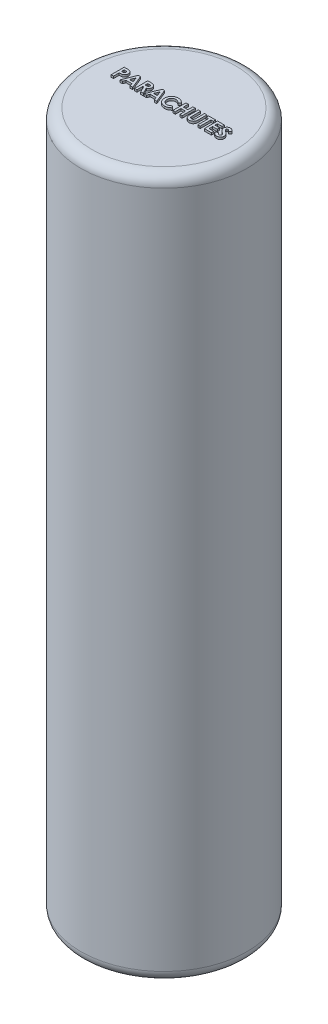
from build123d import *

# Parameters (mm, degrees)
SKETCH1_R           = 48.26
BOSS_EXTRUDE1_DEPTH = 406.4
FILLET1_R           = 6.35
BOSS_EXTRUDE2_DEPTH = 1.27
CUT_EXTRUDE1_DEPTH  = 0.635


with BuildPart() as part:
    # Sketch1 → Boss-Extrude1 (new body)
    with BuildSketch(Plane(origin=(0, 0, 0), x_dir=(1, 0, 0), z_dir=(0, 1, 0))):
        with Locations(Location((0, 0, 0), (0, 0, 270))):
            Circle(SKETCH1_R)
    extrude(amount=BOSS_EXTRUDE1_DEPTH)

    # Fillet1
    fillet1_edges = [part.edges().sort_by_distance(p)[0] for p in [
        (0, 0, -48.26),
        (0, 406.4, -48.26),
    ]]
    fillet(fillet1_edges, radius=FILLET1_R)

    # Sketch2 → Boss-Extrude2 (add)
    # profile 1 of 10: a face of its own
    with BuildSketch(Plane(origin=(0, 406.4, 0), x_dir=(1, 0, 0), z_dir=(0, 1, 0))):
        with BuildLine():
            Line((32.824615385, 6.601862981), (31.801899038, 5.666153846))
            add(Edge.make_bspline(
                [(31.801899038, 5.666153846), (31.758090256, 5.727950689), (31.673983502, 5.846592009), (31.537655226, 6.005455533), (31.401942543, 6.140977942), (31.265588156, 6.252593085), (31.127383472, 6.339622817), (30.987568394, 6.401240829), (30.846935574, 6.440411984), (30.752452027, 6.445289735), (30.705913462, 6.447692308)],
                knots=[0, 0, 0, 0, 1.299362458, 2.494594718, 3.587462134, 4.587049575, 5.512617175, 6.380583204, 7.202344345, 8, 8, 8, 8], degree=3))
            add(Edge.make_bspline(
                [(30.705913462, 6.447692308), (30.662503622, 6.446169928), (30.578690628, 6.443230612), (30.459208986, 6.414014032), (30.353131483, 6.363590506), (30.260561645, 6.297657503), (30.187232676, 6.218223521), (30.128685181, 6.134917697), (30.095718021, 6.042966909), (30.091378894, 5.979811397), (30.089230769, 5.948545673)],
                knots=[0, 0, 0, 0, 1.185010067, 2.2879431, 3.333075148, 4.379039566, 5.372662701, 6.27520591, 7.14612461, 8, 8, 8, 8], degree=3))
            add(Edge.make_bspline(
                [(30.089230769, 5.948545673), (30.09057689, 5.916829083), (30.093287791, 5.852956278), (30.119471404, 5.759342728), (30.158937585, 5.667871393), (30.196649133, 5.612188438), (30.215925481, 5.583725962)],
                knots=[0, 0, 0, 0, 0.967525499, 1.948461899, 2.951351359, 4, 4, 4, 4], degree=3))
            add(Edge.make_bspline(
                [(30.215925481, 5.583725962), (30.233449767, 5.561602376), (30.273788358, 5.510676805), (30.35070579, 5.430018639), (30.447297931, 5.331205325), (30.567281849, 5.217634764), (30.705676682, 5.085222515), (30.86889721, 4.939173752), (31.052245233, 4.774965516), (31.18256476, 4.660616847), (31.250853365, 4.600697115)],
                knots=[0, 0, 0, 0, 0.473873513, 1.090794244, 1.870441696, 2.795289791, 3.865433203, 5.087734844, 6.473946851, 8, 8, 8, 8], degree=3))
            add(Edge.make_bspline(
                [(31.250853365, 4.600697115), (31.314952044, 4.545222942), (31.43659802, 4.439944486), (31.609676087, 4.290518621), (31.761782882, 4.156083813), (31.895134254, 4.038657642), (32.007708726, 3.937008039), (32.099979562, 3.850649119), (32.173073693, 3.781262131), (32.214623427, 3.739352348), (32.232355769, 3.721466346)],
                knots=[0, 0, 0, 0, 1.543621617, 2.929473131, 4.163658386, 5.240097082, 6.164993805, 6.925417477, 7.541396219, 8, 8, 8, 8], degree=3))
            add(Edge.make_bspline(
                [(32.232355769, 3.721466346), (32.299628579, 3.648662758), (32.428950544, 3.508708695), (32.59702351, 3.291823912), (32.735352998, 3.08010014), (32.842367312, 2.869553453), (32.923188827, 2.657146081), (32.980169065, 2.437668745), (33.014294909, 2.208828044), (33.018083675, 2.052672202), (33.02, 1.973689904)],
                knots=[0, 0, 0, 0, 1.206664779, 2.319633467, 3.337109185, 4.282041471, 5.190008762, 6.099243693, 7.03861361, 8, 8, 8, 8], degree=3))
            add(Edge.make_bspline(
                [(33.02, 1.973689904), (33.018636009, 1.896731341), (33.015959807, 1.745735775), (32.983181468, 1.524776257), (32.93644148, 1.313308408), (32.864173259, 1.113633298), (32.776093179, 0.922473321), (32.665672078, 0.742806141), (32.535997635, 0.572813452), (32.387370813, 0.415534083), (32.2229719, 0.272813957), (32.046638441, 0.14576113), (31.85664616, 0.040862837), (31.654618319, -0.045513424), (31.440663062, -0.112041576), (31.215035271, -0.16121208), (30.977389835, -0.190723442), (30.814884462, -0.193808505), (30.731862981, -0.195384615)],
                knots=[0, 0, 0, 0, 1.043214005, 2.046824704, 3.02475056, 3.976699089, 4.921714032, 5.875962561, 6.831408892, 7.817874052, 8.806269674, 9.781291748, 10.760897367, 11.74438705, 12.757449933, 13.795994037, 14.874007457, 16, 16, 16, 16], degree=3))
            add(Edge.make_bspline(
                [(30.731862981, -0.195384615), (30.666691825, -0.194228436), (30.537615562, -0.191938537), (30.347376663, -0.173243418), (30.163679502, -0.143071486), (29.986730995, -0.099826094), (29.815733959, -0.045028317), (29.650681371, 0.021905068), (29.492712645, 0.102011505), (29.340632513, 0.193643685), (29.195180273, 0.300040716), (29.054516739, 0.419027346), (28.920039114, 0.552433643), (28.791101529, 0.699944104), (28.668528964, 0.861976446), (28.548309178, 1.036274067), (28.4357851, 1.226071695), (28.366273972, 1.359216266), (28.330769231, 1.427223558)],
                knots=[0, 0, 0, 0, 1.016823716, 2.013894106, 2.979844003, 3.91962641, 4.853723003, 5.779685073, 6.695824784, 7.614987388, 8.547259901, 9.504950863, 10.487499108, 11.500346958, 12.559593716, 13.656357062, 14.802919212, 16, 16, 16, 16], degree=3))
            Line((28.330769231, 1.427223558), (29.533605769, 2.149230769))
            add(Edge.make_bspline(
                [(29.533605769, 2.149230769), (29.578016894, 2.072033608), (29.663156816, 1.924040052), (29.807434373, 1.725191952), (29.955239365, 1.55491147), (30.109988911, 1.416208324), (30.269801313, 1.307227875), (30.435448504, 1.229342885), (30.607046862, 1.181132165), (30.723931869, 1.175244522), (30.782235577, 1.172307692)],
                knots=[0, 0, 0, 0, 1.283663364, 2.460892379, 3.537111102, 4.529833553, 5.449777664, 6.316464042, 7.160231139, 8, 8, 8, 8], degree=3))
            add(Edge.make_bspline(
                [(30.782235577, 1.172307692), (30.841538795, 1.174706067), (30.956595675, 1.179359263), (31.120824648, 1.222339431), (31.271395989, 1.289821449), (31.401548744, 1.386108982), (31.511753891, 1.49723943), (31.593091615, 1.620877134), (31.644188522, 1.754650146), (31.649590704, 1.847577679), (31.652307692, 1.894314904)],
                knots=[0, 0, 0, 0, 1.13588714, 2.203786484, 3.234766741, 4.283437687, 5.291419208, 6.222934724, 7.106237994, 8, 8, 8, 8], degree=3))
            add(Edge.make_bspline(
                [(31.652307692, 1.894314904), (31.649798665, 1.937796286), (31.644701817, 2.02612455), (31.607160002, 2.157454476), (31.548470694, 2.288724676), (31.479037104, 2.396396045), (31.408379733, 2.486546364), (31.340815348, 2.564657538), (31.258539801, 2.650956709), (31.161761706, 2.745552437), (31.051759754, 2.849277472), (30.928441282, 2.962121655), (30.790394163, 3.083090966), (30.692822187, 3.165494065), (30.641802885, 3.208581731)],
                knots=[0, 0, 0, 0, 0.916159276, 1.861089862, 2.860218735, 3.940849679, 4.552606315, 5.27541173, 6.11797699, 7.06649574, 8.129236253, 9.306560635, 10.591630461, 12, 12, 12, 12], degree=3))
            add(Edge.make_bspline(
                [(30.641802885, 3.208581731), (30.544813159, 3.290644339), (30.35866052, 3.448147322), (30.095603223, 3.680774271), (29.858565045, 3.898185469), (29.649593301, 4.103068596), (29.466025369, 4.291639934), (29.30910445, 4.465431132), (29.180554393, 4.625782751), (29.045283176, 4.815708514), (28.916748474, 5.047146106), (28.805658017, 5.325592359), (28.733587217, 5.604003281), (28.725512686, 5.790913039), (28.721538462, 5.882908654)],
                knots=[0, 0, 0, 0, 1.345494975, 2.582412109, 3.71882943, 4.751509156, 5.681369928, 6.505683931, 7.230279997, 7.856715994, 8.973648664, 10.023341002, 11.027102913, 12, 12, 12, 12], degree=3))
            add(Edge.make_bspline(
                [(28.721538462, 5.882908654), (28.723191336, 5.948147006), (28.726447677, 6.076673568), (28.755494741, 6.265653149), (28.798906685, 6.448002567), (28.861953291, 6.623056527), (28.943780173, 6.790595767), (29.043155742, 6.951440463), (29.161623113, 7.104110235), (29.295127843, 7.248503875), (29.442215874, 7.380463229), (29.599398128, 7.496930582), (29.765784938, 7.595300602), (29.940358435, 7.676905677), (30.124200378, 7.739369177), (30.315956412, 7.78364642), (30.515901576, 7.809981112), (30.65189996, 7.813561007), (30.721177885, 7.815384615)],
                knots=[0, 0, 0, 0, 1.010766082, 1.991317756, 2.957454644, 3.913069143, 4.869106762, 5.843196583, 6.838735724, 7.860187025, 8.887984031, 9.89767229, 10.887916223, 11.879572884, 12.879850636, 13.892031539, 14.926195476, 16, 16, 16, 16], degree=3))
            add(Edge.make_bspline(
                [(30.721177885, 7.815384615), (30.810958646, 7.812100244), (30.989811471, 7.805557426), (31.254250532, 7.754394732), (31.51254355, 7.673936007), (31.720680905, 7.576871406), (31.886291913, 7.482844882), (32.013217281, 7.396277102), (32.142370674, 7.297109058), (32.274793636, 7.185028245), (32.408025541, 7.057922913), (32.545854811, 6.918818904), (32.686403353, 6.766514035), (32.777737621, 6.657708142), (32.824615385, 6.601862981)],
                knots=[0, 0, 0, 0, 1.282922637, 2.555718331, 3.837320111, 5.142675274, 5.830281639, 6.55870424, 7.337177975, 8.157850921, 9.037902056, 9.96903443, 10.957596896, 12, 12, 12, 12], degree=3))
        make_face()
    # profile 2 of 10: a face of its own
    with BuildSketch(Plane(origin=(0, 406.4, 0), x_dir=(1, 0, 0), z_dir=(0, 1, 0))):
        Polygon((23.446153846, 7.62), (27.549230769, 7.62), (27.549230769, 6.252307692), (24.813846154, 6.252307692), (24.813846154, 4.786923077), (27.549230769, 4.786923077), (27.549230769, 3.419230769), (24.813846154, 3.419230769), (24.813846154, 1.367692308), (27.549230769, 1.367692308), (27.549230769, 0), (23.446153846, 0), align=None)
    # profile 3 of 10: a face of its own
    with BuildSketch(Plane(origin=(0, 406.4, 0), x_dir=(1, 0, 0), z_dir=(0, 1, 0))):
        Polygon((18.268461538, 7.62), (22.371538462, 7.62), (22.371538462, 6.252307692), (21.003846154, 6.252307692), (21.003846154, 0), (19.636153846, 0), (19.636153846, 6.252307692), (18.268461538, 6.252307692), align=None)
    # profile 4 of 10: a face of its own
    with BuildSketch(Plane(origin=(0, 406.4, 0), x_dir=(1, 0, 0), z_dir=(0, 1, 0))):
        with BuildLine():
            Line((12.309230769, 7.62), (13.676923077, 7.62))
            Line((13.676923077, 7.62), (13.676923077, 2.662115385))
            add(Edge.make_bspline(
                [(13.676923077, 2.662115385), (13.676997445, 2.610714187), (13.677141087, 2.511433306), (13.684331867, 2.368997746), (13.690911926, 2.238069643), (13.70278422, 2.118792337), (13.720323668, 2.011114803), (13.737307577, 1.914345361), (13.760293618, 1.830216556), (13.794837963, 1.734455952), (13.848059459, 1.626863682), (13.93502043, 1.514728551), (14.035365951, 1.412388967), (14.155635838, 1.327205376), (14.290808555, 1.258299528), (14.440141387, 1.20724792), (14.603423829, 1.178870005), (14.716324681, 1.174537596), (14.774435096, 1.172307692)],
                knots=[0, 0, 0, 0, 1.155499968, 2.231836252, 3.205919964, 4.102923608, 4.924856345, 5.658536265, 6.31071849, 6.882491295, 7.94666036, 8.992281882, 10.060072772, 11.158554251, 12.289267114, 13.461410017, 14.693379945, 16, 16, 16, 16], degree=3))
            add(Edge.make_bspline(
                [(14.774435096, 1.172307692), (14.836170241, 1.174109168), (14.956543321, 1.177621742), (15.129680834, 1.212101454), (15.290093721, 1.267004964), (15.434385495, 1.345366264), (15.562412563, 1.439296016), (15.670784793, 1.546405369), (15.756311759, 1.666907951), (15.812055053, 1.778080759), (15.843352167, 1.880405648), (15.866810914, 1.971829053), (15.88400877, 2.079699621), (15.899611231, 2.202332722), (15.908987108, 2.340998597), (15.919153718, 2.494582077), (15.922879874, 2.664134023), (15.923514971, 2.782196224), (15.923846154, 2.843762019)],
                knots=[0, 0, 0, 0, 1.261321664, 2.459363699, 3.594844139, 4.716940403, 5.803436589, 6.833651888, 7.818396249, 8.814403945, 9.360733334, 10.004355033, 10.743453831, 11.592799886, 12.532235708, 13.585170094, 14.740740724, 16, 16, 16, 16], degree=3))
            Line((15.923846154, 2.843762019), (15.923846154, 7.62))
            Line((15.923846154, 7.62), (17.291538462, 7.62))
            Line((17.291538462, 7.62), (17.291538462, 3.074254808))
            add(Edge.make_bspline(
                [(17.291538462, 3.074254808), (17.291348533, 2.982158227), (17.290983318, 2.805065485), (17.285374719, 2.550570752), (17.273435027, 2.318130637), (17.263407063, 2.10767722), (17.243999519, 1.919494017), (17.22378141, 1.752777433), (17.198011692, 1.608118273), (17.1596679, 1.443441399), (17.093497866, 1.253822009), (16.986823097, 1.035483502), (16.851406383, 0.821716879), (16.691350594, 0.614873718), (16.510632967, 0.422723088), (16.313260399, 0.254039707), (16.10236865, 0.111351756), (15.875754052, -0.001851872), (15.633609465, -0.090142168), (15.37353905, -0.1494688), (15.095720154, -0.189550617), (14.903825391, -0.193400969), (14.804963942, -0.195384615)],
                knots=[0, 0, 0, 0, 1.170808336, 2.251350247, 3.235597562, 4.129743112, 4.929140599, 5.639994148, 6.264258765, 6.79612947, 7.788252245, 8.809469599, 9.879094798, 10.999557536, 12.129761673, 13.226370002, 14.293821979, 15.358369427, 16.438775801, 17.562147481, 18.744053101, 20, 20, 20, 20], degree=3))
            add(Edge.make_bspline(
                [(14.804963942, -0.195384615), (14.739278429, -0.19427823), (14.609682259, -0.192095353), (14.419088355, -0.172848086), (14.234841907, -0.144484851), (14.057289113, -0.103105813), (13.88581372, -0.049651823), (13.720461285, 0.016146315), (13.561846297, 0.093921589), (13.410856345, 0.182958634), (13.267677234, 0.27923687), (13.136818916, 0.385965348), (13.013778252, 0.495251093), (12.902109833, 0.611693314), (12.800974931, 0.734069566), (12.710581833, 0.862657194), (12.631064833, 0.997444775), (12.560423725, 1.140861849), (12.499961832, 1.300197787), (12.448990184, 1.481120234), (12.404460153, 1.686464969), (12.371368061, 1.916694622), (12.341366577, 2.171050383), (12.322377291, 2.450194887), (12.312443141, 2.754136143), (12.310328617, 2.964852314), (12.309230769, 3.074254808)],
                knots=[0, 0, 0, 0, 1.001158378, 1.975264943, 2.917723546, 3.841610987, 4.75185031, 5.653588123, 6.552117133, 7.442167995, 8.324307438, 9.179605724, 10.014504199, 10.831958861, 11.636465792, 12.43274043, 13.225645099, 14.020104002, 14.867201867, 15.819789774, 16.883317127, 18.068162734, 19.364263498, 20.787406516, 22.332041935, 24, 24, 24, 24], degree=3))
            Line((12.309230769, 3.074254808), (12.309230769, 7.62))
        make_face()
    # profile 5 of 10: a face of its own
    with BuildSketch(Plane(origin=(0, 406.4, 0), x_dir=(1, 0, 0), z_dir=(0, 1, 0))):
        Polygon((5.177692308, 7.62), (6.545384615, 7.62), (6.545384615, 4.689230769), (9.183076923, 4.689230769), (9.183076923, 7.62), (10.550769231, 7.62), (10.550769231, 0), (9.183076923, 0), (9.183076923, 3.321538462), (6.545384615, 3.321538462), (6.545384615, 0), (5.177692308, 0), align=None)
    # profile 6 of 10: a face of its own
    with BuildSketch(Plane(origin=(0, 406.4, 0), x_dir=(1, 0, 0), z_dir=(0, 1, 0))):
        with BuildLine():
            Line((3.81, 6.298100962), (2.807127404, 5.339495192))
            add(Edge.make_bspline(
                [(2.807127404, 5.339495192), (2.72205558, 5.427459601), (2.555883656, 5.599281649), (2.288118151, 5.826758898), (2.009651776, 6.016330407), (1.725901538, 6.175986324), (1.431763592, 6.296777404), (1.130638974, 6.384799899), (0.820604915, 6.438463887), (0.610785789, 6.444603997), (0.505252404, 6.447692308)],
                knots=[0, 0, 0, 0, 1.115251505, 2.178435587, 3.19620269, 4.182487026, 5.141301733, 6.088180966, 7.038406374, 8, 8, 8, 8], degree=3))
            add(Edge.make_bspline(
                [(0.505252404, 6.447692308), (0.417119203, 6.445252435), (0.24319804, 6.440437614), (-0.012163803, 6.405140228), (-0.256430603, 6.345115486), (-0.490438524, 6.262390274), (-0.713498988, 6.15534824), (-0.926079668, 6.024072232), (-1.127656457, 5.869747859), (-1.315566641, 5.693173603), (-1.487460273, 5.500252959), (-1.639339243, 5.294407091), (-1.766562242, 5.076107583), (-1.870972089, 4.847565209), (-1.952303323, 4.607722164), (-2.010384042, 4.356739919), (-2.043976378, 4.094319574), (-2.04899026, 3.915928178), (-2.051538462, 3.825264423)],
                knots=[0, 0, 0, 0, 1.035432265, 2.043311493, 3.022114605, 3.98653278, 4.95457646, 5.923598177, 6.917315552, 7.932509744, 8.948865224, 9.949768934, 10.933144597, 11.912367597, 12.897413939, 13.903909035, 14.934704909, 16, 16, 16, 16], degree=3))
            add(Edge.make_bspline(
                [(-2.051538462, 3.825264423), (-2.050804099, 3.761630256), (-2.049356655, 3.636206006), (-2.03351182, 3.450668729), (-2.007997899, 3.270653708), (-1.971072935, 3.096433617), (-1.924897905, 2.927857475), (-1.87072408, 2.763470984), (-1.802763813, 2.605545597), (-1.727326892, 2.452247111), (-1.639594622, 2.307758468), (-1.545003051, 2.169976555), (-1.442433935, 2.039576766), (-1.331222929, 1.917092179), (-1.209804877, 1.804436953), (-1.081317984, 1.698223413), (-0.943594857, 1.601110442), (-0.799496352, 1.510660884), (-0.647777641, 1.432086584), (-0.492555204, 1.360913448), (-0.331475557, 1.303110279), (-0.16649994, 1.256515652), (0.001782081, 1.216893881), (0.175016461, 1.192497538), (0.351701476, 1.174022474), (0.471110889, 1.172881747), (0.531201923, 1.172307692)],
                knots=[0, 0, 0, 0, 1.103660481, 2.175337485, 3.227646561, 4.255952547, 5.262355991, 6.258840057, 7.255597736, 8.242457506, 9.22035537, 10.185017736, 11.140346927, 12.096287581, 13.051739095, 14.01125915, 14.986044842, 15.97314143, 16.960198552, 17.947847494, 18.933482797, 19.925264591, 20.920966487, 21.929612487, 22.958107872, 24, 24, 24, 24], degree=3))
            add(Edge.make_bspline(
                [(0.531201923, 1.172307692), (0.633126645, 1.175255896), (0.833382218, 1.18104835), (1.127286066, 1.226344519), (1.407347153, 1.300854154), (1.631114621, 1.388845703), (1.806430522, 1.475738501), (1.939895926, 1.556110059), (2.077909555, 1.646014472), (2.218179122, 1.748844828), (2.362282382, 1.863367123), (2.507675578, 1.992089608), (2.658080803, 2.130773636), (2.756609776, 2.229755152), (2.807127404, 2.280504808)],
                knots=[0, 0, 0, 0, 1.404581149, 2.759636711, 4.088442092, 5.392261763, 6.066678138, 6.783632037, 7.538459478, 8.336747902, 9.180226004, 10.074962426, 11.012997595, 12, 12, 12, 12], degree=3))
            Line((2.807127404, 2.280504808), (3.779471154, 1.259314904))
            add(Edge.make_bspline(
                [(3.779471154, 1.259314904), (3.711120622, 1.193324611), (3.577715001, 1.064525672), (3.376476325, 0.881643198), (3.175490916, 0.717302964), (2.979614162, 0.565540141), (2.785637399, 0.430775949), (2.593581197, 0.312875796), (2.405619716, 0.208857817), (2.217849875, 0.120476225), (2.029103275, 0.045431074), (1.834905204, -0.019177875), (1.63466198, -0.073834722), (1.42715061, -0.117935619), (1.214306633, -0.153298585), (0.994138112, -0.177168382), (0.768041024, -0.193215253), (0.614675866, -0.194657197), (0.537307692, -0.195384615)],
                knots=[0, 0, 0, 0, 1.244526981, 2.429050516, 3.560637417, 4.644440555, 5.67424972, 6.652764056, 7.595344123, 8.486817594, 9.369275933, 10.254498637, 11.166417451, 12.086725134, 13.032340136, 13.991389299, 14.986715468, 16, 16, 16, 16], degree=3))
            add(Edge.make_bspline(
                [(0.537307692, -0.195384615), (0.395191941, -0.191761801), (0.117110918, -0.184672962), (-0.290409571, -0.132149458), (-0.677543095, -0.044094729), (-1.04523148, 0.080438944), (-1.393357808, 0.239524876), (-1.721833017, 0.434556758), (-2.03012768, 0.665016422), (-2.315751382, 0.928202657), (-2.574111614, 1.218869758), (-2.802472139, 1.530966483), (-2.991371975, 1.866026674), (-3.148219578, 2.219100419), (-3.270872341, 2.591798933), (-3.357199093, 2.984525362), (-3.410436171, 3.396900503), (-3.416260383, 3.67856223), (-3.419230769, 3.822211538)],
                knots=[0, 0, 0, 0, 1.078019885, 2.10938526, 3.111377082, 4.085535484, 5.04941344, 6.010039228, 6.978205633, 7.964457913, 8.951525778, 9.924444315, 10.892603023, 11.863865945, 12.85144698, 13.863884204, 14.910567087, 16, 16, 16, 16], degree=3))
            add(Edge.make_bspline(
                [(-3.419230769, 3.822211538), (-3.417975628, 3.915898392), (-3.415488245, 4.101562837), (-3.38934562, 4.375061607), (-3.352901281, 4.641673986), (-3.29508565, 4.898631654), (-3.22539461, 5.149396306), (-3.138724645, 5.391242421), (-3.03521418, 5.624865091), (-2.9181996, 5.850655414), (-2.785822176, 6.06713422), (-2.637942061, 6.272441617), (-2.478366266, 6.468162539), (-2.303260444, 6.651700384), (-2.115169113, 6.824666652), (-1.913243062, 6.986124004), (-1.698696775, 7.138387921), (-1.470949555, 7.277531887), (-1.234425923, 7.403394999), (-0.992109066, 7.51441164), (-0.744594327, 7.607195986), (-0.492928221, 7.684157179), (-0.236047462, 7.741603268), (0.024214399, 7.785088104), (0.290071881, 7.809396405), (0.468572147, 7.813375829), (0.558677885, 7.815384615)],
                knots=[0, 0, 0, 0, 1.071919942, 2.124283339, 3.142214191, 4.149696895, 5.136002878, 6.119640489, 7.086990633, 8.058538607, 9.028339693, 9.988281803, 10.952401235, 11.916291999, 12.888973767, 13.874849856, 14.873389453, 15.898127285, 16.927174885, 17.938320013, 18.946391617, 19.950418109, 20.947802303, 21.956882652, 22.968648068, 24, 24, 24, 24], degree=3))
            add(Edge.make_bspline(
                [(0.558677885, 7.815384615), (0.635547317, 7.814233129), (0.788486955, 7.811942128), (1.016239739, 7.792844143), (1.242171063, 7.76285095), (1.465472024, 7.717597609), (1.687739898, 7.663876176), (1.906053836, 7.593535368), (2.123857858, 7.515127283), (2.337736033, 7.421406426), (2.547986902, 7.319101646), (2.749685008, 7.203033158), (2.946216843, 7.080343686), (3.133227381, 6.943771931), (3.31421973, 6.798271603), (3.488247466, 6.643163863), (3.653783394, 6.475862609), (3.757664552, 6.357654397), (3.81, 6.298100962)],
                knots=[0, 0, 0, 0, 0.996412454, 1.982464992, 2.961075852, 3.949442424, 4.934965278, 5.923860011, 6.921385422, 7.934793307, 8.949617135, 9.951082467, 10.950285876, 11.951772932, 12.951063433, 13.960125323, 14.972308753, 16, 16, 16, 16], degree=3))
        make_face()
    # profile 7 of 10: a face of its own
    with BuildSketch(Plane(origin=(0, 406.4, 0), x_dir=(1, 0, 0), z_dir=(0, 1, 0))):
        Polygon((-8.497704327, 7.62), (-7.229230769, 7.62), (-4.151923077, 0), (-5.612728365, 0), (-6.204987981, 1.563076923), (-9.525, 1.563076923), (-10.117259615, 0), (-11.576538462, 0), align=None)
        Polygon((-7.864230769, 5.57609375), (-9.006009615, 2.930769231), (-6.722451923, 2.930769231), align=None, mode=Mode.SUBTRACT)
    # profile 8 of 10: a face of its own
    with BuildSketch(Plane(origin=(0, 406.4, 0), x_dir=(1, 0, 0), z_dir=(0, 1, 0))):
        with BuildLine():
            Line((-16.998461538, 7.62), (-15.404855769, 7.62))
            add(Edge.make_bspline(
                [(-15.404855769, 7.62), (-15.299518913, 7.619626115), (-15.096926467, 7.618907028), (-14.804799224, 7.607561741), (-14.536440178, 7.591773843), (-14.291451998, 7.567681092), (-14.069939495, 7.535737017), (-13.871680661, 7.498080238), (-13.69668129, 7.455162265), (-13.543465506, 7.401683085), (-13.405195836, 7.34135938), (-13.276309282, 7.272046337), (-13.153962412, 7.194515779), (-13.038972985, 7.106727666), (-12.930341714, 7.010261286), (-12.82786366, 6.905019535), (-12.732986934, 6.790110006), (-12.646299016, 6.666258782), (-12.567289956, 6.535970135), (-12.497462519, 6.399065178), (-12.44067873, 6.255448701), (-12.390504166, 6.107196274), (-12.354365053, 5.952188598), (-12.329230829, 5.791934701), (-12.310828533, 5.625870471), (-12.309770489, 5.513053806), (-12.309230769, 5.455504808)],
                knots=[0, 0, 0, 0, 1.749336639, 3.364467119, 4.854658419, 6.213483162, 7.451590619, 8.570285859, 9.5643256, 10.440900261, 11.26203566, 12.067320669, 12.869050712, 13.665104639, 14.467235401, 15.27997916, 16.102287765, 16.939272006, 17.78853747, 18.631303466, 19.488103222, 20.351255419, 21.228522269, 22.127379805, 23.044756219, 24, 24, 24, 24], degree=3))
            add(Edge.make_bspline(
                [(-12.309230769, 5.455504808), (-12.310632767, 5.395436873), (-12.313381829, 5.277654602), (-12.328189772, 5.104642051), (-12.355254039, 4.939115745), (-12.39624681, 4.781560323), (-12.443362676, 4.630014824), (-12.506014692, 4.487275359), (-12.576723683, 4.351265987), (-12.660702687, 4.223910614), (-12.752865541, 4.102380421), (-12.860049001, 3.991331683), (-12.975309226, 3.884795948), (-13.105125413, 3.789446255), (-13.243775143, 3.698835401), (-13.394013241, 3.616717836), (-13.554859202, 3.541029315), (-13.667941878, 3.498820168), (-13.725769231, 3.477235577)],
                knots=[0, 0, 0, 0, 1.099860209, 2.156625411, 3.176576793, 4.16617041, 5.135385252, 6.078461593, 7.016046972, 7.938469504, 8.868247731, 9.803980173, 10.76021508, 11.73834243, 12.748633912, 13.790971185, 14.870363756, 16, 16, 16, 16], degree=3))
            Line((-13.725769231, 3.477235577), (-11.967307692, 0))
            Line((-11.967307692, 0), (-13.487644231, 0))
            Line((-13.487644231, 0), (-15.166730769, 3.321538462))
            Line((-15.166730769, 3.321538462), (-15.630769231, 3.321538462))
            Line((-15.630769231, 3.321538462), (-15.630769231, 0))
            Line((-15.630769231, 0), (-16.998461538, 0))
            Line((-16.998461538, 0), (-16.998461538, 7.62))
        make_face()
        with BuildLine():
            Line((-15.630769231, 4.689230769), (-15.098040865, 4.689230769))
            add(Edge.make_bspline(
                [(-15.098040865, 4.689230769), (-15.032910394, 4.689964312), (-14.908199537, 4.69136889), (-14.728848945, 4.697883902), (-14.565955834, 4.713581864), (-14.418820688, 4.733415651), (-14.286703134, 4.756316622), (-14.170781615, 4.789135105), (-14.069269957, 4.82430094), (-13.983371077, 4.868002951), (-13.909981048, 4.917701615), (-13.846613456, 4.974160534), (-13.794199371, 5.039504543), (-13.751059905, 5.111957875), (-13.717502091, 5.192161361), (-13.693007458, 5.279234548), (-13.67931858, 5.374169313), (-13.677743628, 5.439687227), (-13.676923077, 5.473822115)],
                knots=[0, 0, 0, 0, 1.688639943, 3.233382647, 4.650958383, 5.928841754, 7.082724185, 8.122798841, 9.049171256, 9.863274652, 10.613301712, 11.341792392, 12.054588806, 12.776240173, 13.521029143, 14.301969904, 15.115324896, 16, 16, 16, 16], degree=3))
            add(Edge.make_bspline(
                [(-13.676923077, 5.473822115), (-13.678474404, 5.51420618), (-13.6815217, 5.593533192), (-13.711760336, 5.707736273), (-13.759893713, 5.813439039), (-13.82587139, 5.910163897), (-13.908961697, 5.994959585), (-14.004314379, 6.069707659), (-14.113987379, 6.128812843), (-14.215536323, 6.167797993), (-14.307922126, 6.191123211), (-14.391297398, 6.208504956), (-14.487846466, 6.220823898), (-14.597642218, 6.233890329), (-14.720404781, 6.242363248), (-14.856803285, 6.24854679), (-15.006445993, 6.251076781), (-15.110761174, 6.251885575), (-15.165204327, 6.252307692)],
                knots=[0, 0, 0, 0, 1.020303359, 2.004196876, 2.966617323, 3.9489082, 4.950758222, 5.960522915, 7.003732012, 8.091992268, 8.70421221, 9.413913587, 10.24622431, 11.166358409, 12.212345909, 13.359657661, 14.621978493, 16, 16, 16, 16], degree=3))
            Line((-15.165204327, 6.252307692), (-15.630769231, 6.252307692))
            Line((-15.630769231, 6.252307692), (-15.630769231, 4.689230769))
        make_face(mode=Mode.SUBTRACT)
    # profile 9 of 10: a face of its own
    with BuildSketch(Plane(origin=(0, 406.4, 0), x_dir=(1, 0, 0), z_dir=(0, 1, 0))):
        Polygon((-22.467704327, 7.62), (-21.199230769, 7.62), (-18.121923077, 0), (-19.582728365, 0), (-20.174987981, 1.563076923), (-23.495, 1.563076923), (-24.087259615, 0), (-25.546538462, 0), align=None)
        Polygon((-21.834230769, 5.57609375), (-22.976009615, 2.930769231), (-20.692451923, 2.930769231), align=None, mode=Mode.SUBTRACT)
    # profile 10 of 10: a face of its own
    with BuildSketch(Plane(origin=(0, 406.4, 0), x_dir=(1, 0, 0), z_dir=(0, 1, 0))):
        with BuildLine():
            Line((-30.675384615, 7.62), (-29.148942308, 7.62))
            add(Edge.make_bspline(
                [(-29.148942308, 7.62), (-29.049206548, 7.619553562), (-28.85679536, 7.618692288), (-28.579322598, 7.608248202), (-28.323340389, 7.589531764), (-28.088907545, 7.566401206), (-27.876120458, 7.533973064), (-27.684712656, 7.496796738), (-27.514644417, 7.451505154), (-27.363997968, 7.39774467), (-27.228797646, 7.334363161), (-27.100854536, 7.266857329), (-26.983060165, 7.1862915), (-26.869469096, 7.101348716), (-26.766575527, 7.003914426), (-26.667960339, 6.900473023), (-26.577800157, 6.786922106), (-26.49567721, 6.664636179), (-26.421179043, 6.535874563), (-26.35609246, 6.400407069), (-26.303297869, 6.258019336), (-26.259009772, 6.109632449), (-26.223437141, 5.955252876), (-26.199758866, 5.793931168), (-26.18367539, 5.626793735), (-26.182256245, 5.513039893), (-26.181538462, 5.455504808)],
                knots=[0, 0, 0, 0, 1.698747864, 3.27724071, 4.728299578, 6.070144658, 7.288476769, 8.393259625, 9.389771311, 10.283485332, 11.113357557, 11.931608583, 12.74405601, 13.541433047, 14.344816069, 15.154114104, 15.974336324, 16.810834471, 17.661136416, 18.50621059, 19.367396281, 20.244825668, 21.142564693, 22.063065223, 23.020325768, 24, 24, 24, 24], degree=3))
            add(Edge.make_bspline(
                [(-26.181538462, 5.455504808), (-26.182577004, 5.391855113), (-26.184617868, 5.26677564), (-26.20462491, 5.083424479), (-26.238803259, 4.908615747), (-26.283472574, 4.740875251), (-26.345760757, 4.582962694), (-26.41692208, 4.431110234), (-26.50447308, 4.289575348), (-26.604514094, 4.156587605), (-26.713770294, 4.031065751), (-26.834835418, 3.916633994), (-26.965401913, 3.812512255), (-27.104713975, 3.71760933), (-27.253294625, 3.63211666), (-27.411036653, 3.555233698), (-27.579017213, 3.489419397), (-27.69599382, 3.454999051), (-27.755300481, 3.437548077)],
                knots=[0, 0, 0, 0, 1.102006807, 2.165578795, 3.188629044, 4.184801286, 5.166646146, 6.124351954, 7.085497154, 8.042432466, 9.003981491, 9.963833307, 10.922997304, 11.89326795, 12.880200226, 13.889073926, 14.929769137, 16, 16, 16, 16], degree=3))
            add(Edge.make_bspline(
                [(-27.755300481, 3.437548077), (-27.794363259, 3.427829195), (-27.878985815, 3.406774966), (-28.019012903, 3.385399639), (-28.18037942, 3.36574634), (-28.363607169, 3.348856709), (-28.568801785, 3.337375695), (-28.795764587, 3.328409534), (-29.044598429, 3.321890209), (-29.217627644, 3.321658875), (-29.307692308, 3.321538462)],
                knots=[0, 0, 0, 0, 0.618981996, 1.340914327, 2.176866532, 3.120127938, 4.170906482, 5.338178032, 6.614476169, 8, 8, 8, 8], degree=3))
            Line((-29.307692308, 3.321538462), (-29.307692308, 0))
            Line((-29.307692308, 0), (-30.675384615, 0))
            Line((-30.675384615, 0), (-30.675384615, 7.62))
        make_face()
        with BuildLine():
            Line((-29.307692308, 4.689230769), (-28.823810096, 4.689230769))
            add(Edge.make_bspline(
                [(-28.823810096, 4.689230769), (-28.735760088, 4.689789075), (-28.573746766, 4.690816365), (-28.35249378, 4.705671578), (-28.174690624, 4.72835849), (-28.034222829, 4.760896769), (-27.923310201, 4.810277914), (-27.827655002, 4.867402601), (-27.745609097, 4.939635199), (-27.674569418, 5.022173302), (-27.617775337, 5.117013719), (-27.578391599, 5.222612158), (-27.552808697, 5.336749882), (-27.550445879, 5.416182184), (-27.549230769, 5.45703125)],
                knots=[0, 0, 0, 0, 1.8619151, 3.425951444, 4.686033666, 5.651700536, 6.461346321, 7.243864085, 7.999046032, 8.762387399, 9.539336099, 10.322741239, 11.137448474, 12, 12, 12, 12], degree=3))
            add(Edge.make_bspline(
                [(-27.549230769, 5.45703125), (-27.550433379, 5.492720547), (-27.552766733, 5.561966363), (-27.56990818, 5.661905252), (-27.597226715, 5.755068913), (-27.636810223, 5.840484375), (-27.687982326, 5.918006503), (-27.750371475, 5.987604759), (-27.823177095, 6.050769648), (-27.87938729, 6.084203789), (-27.907944712, 6.101189904)],
                knots=[0, 0, 0, 0, 1.102301479, 2.1387299, 3.123554645, 4.094223062, 5.036071848, 5.982632524, 6.975082478, 8, 8, 8, 8], degree=3))
            add(Edge.make_bspline(
                [(-27.907944712, 6.101189904), (-27.932134496, 6.113423372), (-27.983349227, 6.13932413), (-28.07057288, 6.169435655), (-28.171227643, 6.194838043), (-28.28599305, 6.215921781), (-28.414411268, 6.23228495), (-28.556459386, 6.244798682), (-28.71234644, 6.24983094), (-28.820756559, 6.251459337), (-28.877235577, 6.252307692)],
                knots=[0, 0, 0, 0, 0.656809284, 1.390599849, 2.23162475, 3.173112763, 4.218524733, 5.370385145, 6.63003504, 8, 8, 8, 8], degree=3))
            Line((-28.877235577, 6.252307692), (-29.307692308, 6.252307692))
            Line((-29.307692308, 6.252307692), (-29.307692308, 4.689230769))
        make_face(mode=Mode.SUBTRACT)
    extrude(amount=BOSS_EXTRUDE2_DEPTH)

    # Sketch3 → Cut-Extrude1 (cut, symmetric)
    # profile 1 of 10: a face of its own
    with BuildSketch(Plane.XY):
        with BuildLine():
            Line((-20.32, 111.75310652), (-20.32, 115.82361934))
            add(Edge.make_bspline(
                [(-20.32, 115.82361934), (-20.318809499, 116.089581369), (-20.316512774, 116.602677872), (-20.288661851, 117.342605216), (-20.238751441, 118.025224514), (-20.177069651, 118.650378523), (-20.090595585, 119.217811539), (-19.991455562, 119.728229816), (-19.8706881, 120.181753213), (-19.727294369, 120.583451077), (-19.558386637, 120.944073122), (-19.377974474, 121.284936908), (-19.164123786, 121.600912205), (-18.93224935, 121.899417212), (-18.677527223, 122.17819389), (-18.400964122, 122.439308026), (-18.098540782, 122.680070871), (-17.772340626, 122.898972996), (-17.429004864, 123.097660053), (-17.06775054, 123.271217478), (-16.688052015, 123.412004911), (-16.292353072, 123.530105991), (-15.88067437, 123.624966482), (-15.450483105, 123.688108511), (-15.004783297, 123.730997791), (-14.701439716, 123.734782175), (-14.548012821, 123.736696263)],
                knots=[0, 0, 0, 0, 1.698787518, 3.27731721, 4.728409951, 6.070286353, 7.288646904, 8.393455548, 9.389990496, 10.283725379, 11.113616976, 11.931887102, 12.744353494, 13.547053751, 14.344590688, 15.153907614, 15.974148981, 16.810666655, 17.660988447, 18.506082349, 19.367288142, 20.244738011, 21.142497992, 22.06302001, 23.020302899, 24, 24, 24, 24], degree=3))
            add(Edge.make_bspline(
                [(-14.548012821, 123.736696263), (-14.378280301, 123.733926816), (-14.044735043, 123.728484511), (-13.555798599, 123.675132407), (-13.089642029, 123.583990111), (-12.642333867, 123.464872052), (-12.221234342, 123.298769818), (-11.816292172, 123.109007794), (-11.43887428, 122.875532859), (-11.084208737, 122.608777695), (-10.74960195, 122.317349685), (-10.44401003, 121.994800726), (-10.16752425, 121.644929962), (-9.90818804, 121.277453815), (-9.686766385, 120.877230228), (-9.480227897, 120.458269631), (-9.30522181, 120.010024724), (-9.213365596, 119.698127937), (-9.166794872, 119.539997545)],
                knots=[0, 0, 0, 0, 1.101964615, 2.165495883, 3.188506962, 4.184641065, 5.166448333, 6.124117473, 7.085225874, 8.042124548, 9.003636759, 9.963451826, 10.9225791, 11.897800977, 12.880319672, 13.889154746, 14.929810112, 16, 16, 16, 16], degree=3))
            add(Edge.make_bspline(
                [(-9.166794872, 119.539997545), (-9.140877852, 119.435830137), (-9.084733241, 119.210169987), (-9.02773237, 118.836764419), (-8.975323573, 118.406453708), (-8.930284557, 117.917846378), (-8.899668521, 117.370660735), (-8.875758758, 116.765426597), (-8.858373891, 116.101869682), (-8.857757, 115.640458443), (-8.857435897, 115.400286007)],
                knots=[0, 0, 0, 0, 0.618981996, 1.340914327, 2.176866532, 3.120127938, 4.170906482, 5.338178032, 6.614476169, 8, 8, 8, 8], degree=3))
            Line((-8.857435897, 115.400286007), (0, 115.400286007))
            Line((0, 115.400286007), (0, 111.75310652))
            Line((0, 111.75310652), (-20.32, 111.75310652))
        make_face()
        with BuildLine():
            Line((-12.504615385, 115.400286007), (-12.504615385, 116.690638571))
            add(Edge.make_bspline(
                [(-12.504615385, 116.690638571), (-12.506103959, 116.925438871), (-12.508842957, 117.35747491), (-12.548459595, 117.947479701), (-12.608950483, 118.421630201), (-12.69573904, 118.796187997), (-12.827364082, 119.092022316), (-12.979895936, 119.346871544), (-13.172484504, 119.567277954), (-13.396257382, 119.754070598), (-13.648333329, 119.905856159), (-13.928036938, 120.012551799), (-14.231379666, 120.079834027), (-14.443168333, 120.086228393), (-14.552083333, 120.089516776)],
                knots=[0, 0, 0, 0, 1.862197296, 3.426470689, 4.686743892, 5.65255712, 6.462325617, 7.244961981, 8.000258385, 8.771939908, 9.549006364, 10.32248703, 11.137317743, 12, 12, 12, 12], degree=3))
            add(Edge.make_bspline(
                [(-14.552083333, 120.089516776), (-14.64726618, 120.086332226), (-14.831943787, 120.080153433), (-15.098291918, 120.034136772), (-15.346096347, 119.962716568), (-15.57190275, 119.853564642), (-15.780977857, 119.721044257), (-15.966813108, 119.552925666), (-16.135420903, 119.359050377), (-16.224555286, 119.209118637), (-16.269839744, 119.132946263)],
                knots=[0, 0, 0, 0, 1.102449765, 2.139017612, 3.12397484, 4.080535277, 5.035673127, 5.982361139, 6.974944601, 8, 8, 8, 8], degree=3))
            add(Edge.make_bspline(
                [(-16.269839744, 119.132946263), (-16.302462324, 119.068440171), (-16.371531013, 118.931867554), (-16.451828413, 118.699271148), (-16.519568116, 118.430858446), (-16.575791415, 118.124817361), (-16.619426534, 117.782368779), (-16.652796484, 117.403573799), (-16.666215841, 116.987874987), (-16.670558233, 116.698781337), (-16.672820513, 116.548170622)],
                knots=[0, 0, 0, 0, 0.656809284, 1.390599849, 2.23162475, 3.173112763, 4.218524733, 5.370385145, 6.63003504, 8, 8, 8, 8], degree=3))
            Line((-16.672820513, 116.548170622), (-16.672820513, 115.400286007))
            Line((-16.672820513, 115.400286007), (-12.504615385, 115.400286007))
        make_face(mode=Mode.SUBTRACT)
    # profile 2 of 10: a face of its own
    with BuildSketch(Plane.XY):
        Polygon((-20.32, 133.900766776), (-20.32, 137.28336293), (0, 145.489516776), (0, 141.594036007), (-4.168205128, 140.014677033), (-4.168205128, 131.161311648), (0, 129.581952674), (0, 125.690542417), align=None)
        Polygon((-14.869583333, 135.590029597), (-7.815384615, 132.545286007), (-7.815384615, 138.634773186), align=None, mode=Mode.SUBTRACT)
    # profile 3 of 10: a face of its own
    with BuildSketch(Plane.XY):
        with BuildLine():
            Line((-20.32, 148.485414212), (-20.32, 152.735029597))
            add(Edge.make_bspline(
                [(-20.32, 152.735029597), (-20.319017669, 153.01592996), (-20.317128369, 153.556180483), (-20.286679733, 154.335158937), (-20.24523188, 155.050875482), (-20.178870657, 155.703686481), (-20.10063556, 156.295177563), (-19.998654889, 156.82345306), (-19.884576025, 157.290176826), (-19.741852304, 157.69871552), (-19.581117163, 158.067523268), (-19.395884675, 158.410909939), (-19.190149667, 158.739014672), (-18.950592634, 159.041263854), (-18.698588161, 159.335328237), (-18.417140762, 159.60673129), (-18.111139385, 159.860136083), (-17.780645163, 160.090967895), (-17.43264288, 160.303238711), (-17.065873841, 160.485834247), (-16.683321435, 160.641515427), (-16.286871594, 160.772326354), (-15.872569846, 160.86985933), (-15.445140785, 160.936644409), (-15.002326124, 160.985782556), (-14.701478461, 160.988594959), (-14.548012821, 160.990029597)],
                knots=[0, 0, 0, 0, 1.748890285, 3.363608654, 4.853419723, 6.211897754, 7.448506646, 8.566916444, 9.560702549, 10.437053547, 11.257979428, 12.063058964, 12.86458444, 13.665575447, 14.461919362, 15.274455744, 16.096554533, 16.933325211, 17.78237398, 18.632472903, 19.481227396, 20.352186419, 21.229229428, 22.127857616, 23.044999956, 24, 24, 24, 24], degree=3))
            add(Edge.make_bspline(
                [(-14.548012821, 160.990029597), (-14.387835232, 160.986277615), (-14.073756176, 160.978920664), (-13.612339028, 160.93962066), (-13.169817029, 160.866557332), (-12.749030026, 160.759498514), (-12.345668423, 160.631355398), (-11.966027663, 160.46539771), (-11.603391946, 160.276678274), (-11.263737174, 160.052795813), (-10.939764058, 159.806941012), (-10.643239184, 159.521409801), (-10.360106068, 159.212335832), (-10.100006392, 158.870313787), (-9.864559318, 158.496367646), (-9.644201327, 158.097529092), (-9.442846349, 157.668286182), (-9.330221459, 157.366777104), (-9.272628205, 157.212593699)],
                knots=[0, 0, 0, 0, 1.099808295, 2.156523617, 3.176426857, 4.17500812, 5.135317955, 6.078349783, 7.015890908, 7.9382699, 8.868004242, 9.803692517, 10.759882289, 11.743580734, 12.748787378, 13.791075452, 14.870417076, 16, 16, 16, 16], degree=3))
            Line((-9.272628205, 157.212593699), (0, 161.901824469))
            Line((0, 161.901824469), (0, 157.847593699))
            Line((0, 157.847593699), (-8.857435897, 153.370029597))
            Line((-8.857435897, 153.370029597), (-8.857435897, 152.132593699))
            Line((-8.857435897, 152.132593699), (0, 152.132593699))
            Line((0, 152.132593699), (0, 148.485414212))
            Line((0, 148.485414212), (-20.32, 148.485414212))
        make_face()
        with BuildLine():
            Line((-12.504615385, 152.132593699), (-12.504615385, 153.553202674))
            add(Edge.make_bspline(
                [(-12.504615385, 153.553202674), (-12.5065715, 153.72688393), (-12.51031704, 154.059446215), (-12.527690407, 154.537714461), (-12.569551636, 154.972096089), (-12.622441735, 155.364456481), (-12.683510993, 155.716769958), (-12.771026946, 156.025894009), (-12.864802506, 156.296591763), (-12.981341202, 156.525655442), (-13.113870974, 156.721362186), (-13.264428091, 156.890342433), (-13.438678782, 157.030113326), (-13.631887666, 157.145151901), (-13.845763628, 157.234639404), (-14.077958795, 157.299958427), (-14.331118167, 157.336462101), (-14.505832606, 157.340661973), (-14.596858974, 157.34285011)],
                knots=[0, 0, 0, 0, 1.688639943, 3.233382647, 4.650958383, 5.928841754, 7.082724185, 8.122798841, 9.049171256, 9.863274652, 10.613301712, 11.341792392, 12.054588806, 12.776240173, 13.521029143, 14.301969904, 15.115324896, 16, 16, 16, 16], degree=3))
            add(Edge.make_bspline(
                [(-14.596858974, 157.34285011), (-14.704610009, 157.338915521), (-14.914950215, 157.331234833), (-15.218619843, 157.248189611), (-15.501714949, 157.122874882), (-15.76039324, 156.945503817), (-15.986488289, 156.724089455), (-16.186220994, 156.469926166), (-16.342397185, 156.176397381), (-16.452067725, 155.907283534), (-16.513628941, 155.660129554), (-16.559856414, 155.437843298), (-16.594206838, 155.180660632), (-16.622012914, 154.88727834), (-16.646833482, 154.560287888), (-16.662628163, 154.196485791), (-16.669585063, 153.797460585), (-16.671710977, 153.519283538), (-16.672820513, 153.37410011)],
                knots=[0, 0, 0, 0, 1.020140795, 1.991411262, 2.965409065, 3.947543434, 4.949233831, 5.95883764, 7.001880521, 8.094604842, 8.706727239, 9.41631554, 10.248493651, 11.167128553, 12.212949395, 13.360078347, 14.622198054, 16, 16, 16, 16], degree=3))
            Line((-16.672820513, 153.37410011), (-16.672820513, 152.132593699))
            Line((-16.672820513, 152.132593699), (-12.504615385, 152.132593699))
        make_face(mode=Mode.SUBTRACT)
    # profile 4 of 10: a face of its own
    with BuildSketch(Plane.XY):
        Polygon((-20.32, 171.15410011), (-20.32, 174.536696263), (0, 182.74285011), (0, 178.84736934), (-4.168205128, 177.268010366), (-4.168205128, 168.414644981), (0, 166.835286007), (0, 162.943875751), align=None)
        Polygon((-14.869583333, 172.84336293), (-7.815384615, 169.79861934), (-7.815384615, 175.88810652), align=None, mode=Mode.SUBTRACT)
    # profile 5 of 10: a face of its own
    with BuildSketch(Plane.XY):
        with BuildLine():
            Line((-16.794935897, 203.974644981), (-14.238653846, 201.300318058))
            add(Edge.make_bspline(
                [(-14.238653846, 201.300318058), (-14.473266248, 201.07348099), (-14.931537772, 200.630397129), (-15.537577641, 199.916061505), (-16.044752231, 199.175076329), (-16.463322332, 198.414835563), (-16.792772907, 197.63385131), (-17.025730625, 196.829504333), (-17.169339198, 196.002969921), (-17.185644849, 195.4434222), (-17.193846154, 195.161984725)],
                knots=[0, 0, 0, 0, 1.115315123, 2.178559852, 3.196385012, 4.180486591, 5.141138664, 6.08807191, 7.038351522, 8, 8, 8, 8], degree=3))
            add(Edge.make_bspline(
                [(-17.193846154, 195.161984725), (-17.187347684, 194.926959126), (-17.17452367, 194.463162001), (-17.08028445, 193.782250631), (-16.920631033, 193.130676764), (-16.698713943, 192.507923453), (-16.419245914, 191.910911741), (-16.067974753, 191.345200866), (-15.656624555, 190.80775064), (-15.185915138, 190.304840722), (-14.66782502, 189.850821851), (-14.122183253, 189.441744398), (-13.539338754, 189.102908387), (-12.927791184, 188.826316933), (-12.287319709, 188.608356508), (-11.617956389, 188.453661249), (-10.918189919, 188.364030712), (-10.442476621, 188.350667386), (-10.200705128, 188.343875751)],
                knots=[0, 0, 0, 0, 1.035268443, 2.04298821, 3.02163646, 3.985902049, 4.951223231, 5.920091634, 6.913651787, 7.92868536, 8.949353712, 9.945284791, 10.92850487, 11.913014323, 12.897904816, 13.904240668, 14.934873455, 16, 16, 16, 16], degree=3))
            add(Edge.make_bspline(
                [(-10.200705128, 188.343875751), (-10.031018818, 188.34586346), (-9.696563613, 188.349781276), (-9.203067855, 188.391498401), (-8.723282187, 188.460971286), (-8.25835972, 188.557747492), (-7.807693387, 188.681806566), (-7.370227907, 188.825116176), (-6.951179175, 189.008159133), (-6.542701048, 189.20950397), (-6.154626431, 189.441144886), (-5.786699827, 189.694792397), (-5.438838882, 189.968108892), (-5.112280465, 190.264744544), (-4.811725608, 190.58843464), (-4.528990619, 190.931361572), (-4.26853534, 191.296932052), (-4.03450734, 191.685292603), (-3.816368433, 192.084691004), (-3.635728433, 192.503355343), (-3.473341802, 192.929574797), (-3.351178673, 193.370829845), (-3.244922433, 193.819346957), (-3.180028471, 194.281369306), (-3.130717633, 194.752512062), (-3.127681657, 195.070939506), (-3.126153846, 195.231183443)],
                knots=[0, 0, 0, 0, 1.103738238, 2.175490744, 3.219137561, 4.256155604, 5.262629953, 6.259184223, 7.247888397, 8.234817694, 9.220364322, 10.185094651, 11.140491148, 12.096499151, 13.05201798, 14.011605636, 14.986460005, 15.968997565, 16.960259839, 17.944382265, 18.933125845, 19.924977513, 20.920749559, 21.929466621, 22.958034467, 24, 24, 24, 24], degree=3))
            add(Edge.make_bspline(
                [(-3.126153846, 195.231183443), (-3.13398605, 195.502993612), (-3.149374293, 196.037029912), (-3.270586804, 196.820618058), (-3.46785216, 197.568503296), (-3.707531454, 198.16390126), (-3.939934518, 198.630646858), (-4.148854492, 198.988953434), (-4.389705952, 199.355539512), (-4.663489018, 199.729846807), (-4.969007388, 200.114047867), (-5.312230789, 200.501784687), (-5.682065239, 200.902859151), (-5.946014487, 201.16560394), (-6.081346154, 201.300318058)],
                knots=[0, 0, 0, 0, 1.404693586, 2.759857621, 4.088769373, 5.395275838, 6.0697462, 6.783214465, 7.53810233, 8.336454657, 9.18000028, 10.074808326, 11.012918585, 12, 12, 12, 12], degree=3))
            Line((-6.081346154, 201.300318058), (-3.358173077, 203.893234725))
            add(Edge.make_bspline(
                [(-3.358173077, 203.893234725), (-3.182198963, 203.71096664), (-2.838735126, 203.355218317), (-2.351048527, 202.818581848), (-1.912807904, 202.282620757), (-1.508107043, 201.760282748), (-1.148735863, 201.243011379), (-0.834335455, 200.730861506), (-0.556954179, 200.22963089), (-0.321269934, 199.728911315), (-0.121149531, 199.225587048), (0.051141, 198.707725525), (0.196892592, 198.173743595), (0.314494984, 197.620379942), (0.408796226, 197.052796002), (0.472449019, 196.465679946), (0.515240674, 195.862754378), (0.519085859, 195.453780624), (0.521025641, 195.247465494)],
                knots=[0, 0, 0, 0, 1.244526981, 2.429050516, 3.560637417, 4.644440555, 5.67424972, 6.652764056, 7.595344123, 8.486817594, 9.369275933, 10.254498637, 11.166417451, 12.086725134, 13.032340136, 13.991389299, 14.986715468, 16, 16, 16, 16], degree=3))
            add(Edge.make_bspline(
                [(0.521025641, 195.247465494), (0.511364804, 194.868490156), (0.492461231, 194.126940762), (0.352398555, 193.04021946), (0.117585945, 192.007863394), (-0.214503852, 191.027361036), (-0.638733003, 190.099024161), (-1.158818022, 189.223090268), (-1.773377126, 188.400971167), (-2.475207084, 187.639307962), (-3.250319355, 186.950347344), (-4.082577289, 186.341385943), (-4.97607113, 185.837653049), (-5.917601118, 185.419392773), (-6.911463822, 185.092318738), (-7.958734298, 184.862114066), (-9.058401341, 184.720148524), (-9.809499281, 184.704617292), (-10.192564103, 184.696696263)],
                knots=[0, 0, 0, 0, 1.078019885, 2.10938526, 3.111377082, 4.085535484, 5.04941344, 6.010039228, 6.978205633, 7.964457913, 8.951525778, 9.924444315, 10.892603023, 11.863865945, 12.85144698, 13.863884204, 14.910567087, 16, 16, 16, 16], degree=3))
            add(Edge.make_bspline(
                [(-10.192564103, 184.696696263), (-10.442401709, 184.700010314), (-10.937518783, 184.706577953), (-11.668099586, 184.776898647), (-12.379392808, 184.872412758), (-13.065320192, 185.029314037), (-13.733689394, 185.211718716), (-14.378585736, 185.446720084), (-15.002725763, 185.719745127), (-15.605321196, 186.03148904), (-16.179864802, 186.388544806), (-16.730020639, 186.777283636), (-17.248662022, 187.207133463), (-17.737927247, 187.673743659), (-18.203358083, 188.172802364), (-18.633508041, 188.712856609), (-19.039917028, 189.284695975), (-19.41046434, 189.892281695), (-19.747470746, 190.521768732), (-20.037406335, 191.170098331), (-20.286181692, 191.828912515), (-20.490999359, 192.500208899), (-20.644298771, 193.185174483), (-20.76022866, 193.87921956), (-20.825058687, 194.588169268), (-20.835669416, 195.064170463), (-20.841025641, 195.304452674)],
                knots=[0, 0, 0, 0, 1.071814294, 2.12407397, 3.147667899, 4.14936388, 5.141177959, 6.119239245, 7.091825145, 8.063277363, 9.028022524, 9.992609517, 10.952139039, 11.915934802, 12.892469547, 13.878248468, 14.87668965, 15.901326483, 16.93027266, 17.938917451, 18.9468897, 19.950817235, 20.948103127, 21.957084021, 22.968749718, 24, 24, 24, 24], degree=3))
            add(Edge.make_bspline(
                [(-20.841025641, 195.304452674), (-20.837952136, 195.509436883), (-20.831837083, 195.917274038), (-20.780951556, 196.524628739), (-20.700809452, 197.127059613), (-20.580737034, 197.722727027), (-20.43532381, 198.314309667), (-20.256213972, 198.899330729), (-20.037741949, 199.476177003), (-19.796065787, 200.049849288), (-19.520930024, 200.608906547), (-19.212969451, 201.148490191), (-18.880240608, 201.669937213), (-18.517020509, 202.170104156), (-18.128644385, 202.652513907), (-17.71512509, 203.116651747), (-17.268961491, 203.558063921), (-16.953743227, 203.835082631), (-16.794935897, 203.974644981)],
                knots=[0, 0, 0, 0, 0.996333415, 1.982307736, 2.96084097, 3.949129141, 4.93457382, 5.921430247, 6.92116383, 7.931890485, 8.946633814, 9.948019707, 10.950686436, 11.952094051, 12.951305284, 13.960287133, 14.972390273, 16, 16, 16, 16], degree=3))
        make_face()
    # profile 6 of 10: a face of its own
    with BuildSketch(Plane.XY):
        Polygon((-20.32, 207.621824469), (-20.32, 211.269003956), (-12.504615385, 211.269003956), (-12.504615385, 218.30285011), (-20.32, 218.30285011), (-20.32, 221.950029597), (0, 221.950029597), (0, 218.30285011), (-8.857435897, 218.30285011), (-8.857435897, 211.269003956), (0, 211.269003956), (0, 207.621824469), align=None)
    # profile 7 of 10: a face of its own
    with BuildSketch(Plane.XY):
        with BuildLine():
            Line((-20.32, 226.639260366), (-20.32, 230.286439853))
            Line((-20.32, 230.286439853), (-7.098974359, 230.286439853))
            add(Edge.make_bspline(
                [(-7.098974359, 230.286439853), (-6.961905445, 230.286646234), (-6.697158255, 230.287044855), (-6.317317514, 230.306112988), (-5.966869598, 230.324084464), (-5.648655171, 230.354662359), (-5.36168643, 230.402625944), (-5.104906102, 230.447406701), (-4.880602564, 230.508801947), (-4.625111699, 230.600741608), (-4.338095101, 230.744280194), (-4.035567828, 230.971945074), (-3.766293014, 231.2438155), (-3.54019732, 231.563984479), (-3.348962979, 231.921442019), (-3.222477478, 232.323232601), (-3.136684634, 232.7562946), (-3.129729759, 233.058009217), (-3.126153846, 233.213138571)],
                knots=[0, 0, 0, 0, 1.155195489, 2.231248153, 3.20507519, 4.113220553, 4.92363642, 5.657123012, 6.309133385, 6.880755525, 7.944644177, 8.999147208, 10.058600405, 11.156792429, 12.29246015, 13.460660758, 14.694375292, 16, 16, 16, 16], degree=3))
            add(Edge.make_bspline(
                [(-3.126153846, 233.213138571), (-3.130957783, 233.377765623), (-3.140324645, 233.698760503), (-3.232270543, 234.16046054), (-3.378679904, 234.58822823), (-3.587643368, 234.973006328), (-3.838122721, 235.314411724), (-4.123747612, 235.603404747), (-4.445088004, 235.831475201), (-4.741548275, 235.980128602), (-5.014415913, 236.063576949), (-5.258206653, 236.126175546), (-5.544553779, 236.171629972), (-5.871468459, 236.21418468), (-6.241332616, 236.238310619), (-6.65221284, 236.265786361), (-7.104359124, 236.275639392), (-7.419190525, 236.277345199), (-7.583365385, 236.278234725)],
                knots=[0, 0, 0, 0, 1.26131785, 2.459356261, 3.594833267, 4.716926138, 5.803419038, 6.833631221, 7.818372604, 8.814377287, 9.360705024, 10.004324776, 10.743421339, 11.582437492, 12.532246195, 13.585177397, 14.740744533, 16, 16, 16, 16], degree=3))
            Line((-7.583365385, 236.278234725), (-20.32, 236.278234725))
            Line((-20.32, 236.278234725), (-20.32, 239.925414212))
            Line((-20.32, 239.925414212), (-8.198012821, 239.925414212))
            add(Edge.make_bspline(
                [(-8.198012821, 239.925414212), (-7.95242194, 239.924907735), (-7.480174627, 239.923933829), (-6.801522006, 239.908977566), (-6.181681698, 239.877138387), (-5.620472585, 239.850397151), (-5.118650717, 239.798643695), (-4.67407314, 239.744728751), (-4.288315436, 239.676009464), (-3.849176882, 239.5737595), (-3.34352674, 239.397305047), (-2.761284011, 239.112843419), (-2.191266317, 238.751714625), (-1.63957935, 238.324968528), (-1.127573216, 237.842794157), (-0.676819711, 237.317978332), (-0.301762126, 236.75292854), (0.001489121, 236.150254778), (0.234990745, 235.503597361), (0.400035644, 234.811431134), (0.505058285, 234.069797843), (0.515596502, 233.558145056), (0.521025641, 233.294548828)],
                knots=[0, 0, 0, 0, 1.170930413, 2.251584989, 3.235934929, 4.130173708, 4.929654547, 5.640582214, 6.264911921, 6.796838084, 7.789064304, 8.810388137, 9.880124863, 11.000704429, 12.131026409, 13.227749078, 14.29171941, 15.356377855, 16.43689688, 17.561893293, 18.743922147, 20, 20, 20, 20], degree=3))
            add(Edge.make_bspline(
                [(0.521025641, 233.294548828), (0.518066808, 233.119390008), (0.51222909, 232.773805249), (0.461024488, 232.265518297), (0.384947615, 231.774327307), (0.276111573, 231.299971714), (0.127542786, 230.844087196), (-0.048029296, 230.403723135), (-0.248917088, 229.977284351), (-0.492717373, 229.578097631), (-0.748801529, 229.196356325), (-1.028997163, 228.844867158), (-1.320878849, 228.518225807), (-1.631127559, 228.220226264), (-1.957533221, 227.950589999), (-2.300415344, 227.709526558), (-2.659853848, 227.497486019), (-3.042297614, 227.309105536), (-3.4671957, 227.147887041), (-3.949647202, 227.01190564), (-4.495957685, 226.893694007), (-5.109726131, 226.804207335), (-5.788157957, 226.725335975), (-6.533842222, 226.674230572), (-7.344366102, 226.647851329), (-7.906273882, 226.64219638), (-8.198012821, 226.639260366)],
                knots=[0, 0, 0, 0, 1.001237316, 1.975420686, 2.917953599, 3.841913885, 4.754568974, 5.656377887, 6.55158913, 7.445656762, 8.327865759, 9.178398172, 10.013362476, 10.830881591, 11.635451955, 12.431789376, 13.224756564, 14.019278107, 14.866442763, 15.819105778, 16.882716987, 18.059987251, 19.363897986, 20.787153213, 22.331910422, 24, 24, 24, 24], degree=3))
            Line((-8.198012821, 226.639260366), (-20.32, 226.639260366))
        make_face()
    # profile 8 of 10: a face of its own
    with BuildSketch(Plane.XY):
        Polygon((-20.32, 242.530542417), (-20.32, 253.472080879), (-16.672820513, 253.472080879), (-16.672820513, 249.824901392), (0, 249.824901392), (0, 246.177721904), (-16.672820513, 246.177721904), (-16.672820513, 242.530542417), align=None)
    # profile 9 of 10: a face of its own
    with BuildSketch(Plane.XY):
        Polygon((-20.32, 256.337721904), (-20.32, 267.279260366), (-16.672820513, 267.279260366), (-16.672820513, 259.984901392), (-12.765128205, 259.984901392), (-12.765128205, 267.279260366), (-9.117948718, 267.279260366), (-9.117948718, 259.984901392), (-3.647179487, 259.984901392), (-3.647179487, 267.279260366), (0, 267.279260366), (0, 256.337721904), align=None)
    # profile 10 of 10: a face of its own
    with BuildSketch(Plane.XY):
        with BuildLine():
            Line((-17.604967949, 281.346952674), (-15.10974359, 278.619709084))
            add(Edge.make_bspline(
                [(-15.10974359, 278.619709084), (-15.27453517, 278.502885663), (-15.590912025, 278.278600985), (-16.014548089, 277.915058917), (-16.375941179, 277.553158428), (-16.67358156, 277.18954673), (-16.905660846, 276.821000906), (-17.069975545, 276.4481607), (-17.174431958, 276.073139845), (-17.187439295, 275.821183721), (-17.193846154, 275.697080879)],
                knots=[0, 0, 0, 0, 1.299362458, 2.494594718, 3.587462134, 4.587049575, 5.512617175, 6.380583204, 7.202344345, 8, 8, 8, 8], degree=3))
            add(Edge.make_bspline(
                [(-17.193846154, 275.697080879), (-17.189907179, 275.58126417), (-17.182302054, 275.357652535), (-17.102903667, 275.040362388), (-16.974600146, 274.755223588), (-16.797369301, 274.509831463), (-16.585704245, 274.312418836), (-16.360376461, 274.158918728), (-16.114694981, 274.069719516), (-15.946202323, 274.058264575), (-15.862788462, 274.052593699)],
                knots=[0, 0, 0, 0, 1.184157716, 2.286297433, 3.324836695, 4.370048774, 5.362957217, 6.276446515, 7.146738784, 8, 8, 8, 8], degree=3))
            add(Edge.make_bspline(
                [(-15.862788462, 274.052593699), (-15.778210888, 274.056183356), (-15.607883409, 274.063412425), (-15.358247276, 274.133235393), (-15.114323714, 274.238478542), (-14.965835834, 274.339042668), (-14.889935897, 274.390446263)],
                knots=[0, 0, 0, 0, 0.967525499, 1.948461899, 2.951351359, 4, 4, 4, 4], degree=3))
            add(Edge.make_bspline(
                [(-14.889935897, 274.390446263), (-14.831108054, 274.437359274), (-14.694911683, 274.545970798), (-14.475946799, 274.746967338), (-14.21713535, 275.009420849), (-13.913099805, 275.326809082), (-13.560953526, 275.698024844), (-13.16657883, 276.128823258), (-12.733811336, 276.622351908), (-12.428712444, 276.968509831), (-12.268525641, 277.150253956)],
                knots=[0, 0, 0, 0, 0.473854981, 1.097054127, 1.870604305, 2.795416232, 3.865517794, 5.093525133, 6.47400653, 8, 8, 8, 8], degree=3))
            add(Edge.make_bspline(
                [(-12.268525641, 277.150253956), (-12.120637179, 277.321221858), (-11.839975603, 277.645683418), (-11.440966477, 278.1067427), (-11.083598848, 278.514575197), (-10.765196642, 278.865471835), (-10.498872063, 279.169918233), (-10.268240462, 279.414449431), (-10.083390968, 279.609530853), (-9.971613824, 279.72031424), (-9.923910256, 279.767593699)],
                knots=[0, 0, 0, 0, 1.543627419, 2.929484142, 4.163674036, 5.24627963, 6.164986907, 6.925413438, 7.541394495, 8, 8, 8, 8], degree=3))
            add(Edge.make_bspline(
                [(-9.923910256, 279.767593699), (-9.729758296, 279.946970351), (-9.356530045, 280.29179527), (-8.778290065, 280.740220655), (-8.214307994, 281.10766595), (-7.655366987, 281.395243227), (-7.088561677, 281.610436003), (-6.501668055, 281.761196851), (-5.890230019, 281.852861166), (-5.473799895, 281.862900503), (-5.263173077, 281.867978315)],
                knots=[0, 0, 0, 0, 1.206593015, 2.319495511, 3.336910718, 4.276265636, 5.184178927, 6.099356736, 7.038670786, 8, 8, 8, 8], degree=3))
            add(Edge.make_bspline(
                [(-5.263173077, 281.867978315), (-5.057950243, 281.864341004), (-4.655295404, 281.857204465), (-4.066070007, 281.769795566), (-3.502155798, 281.645155577), (-2.969688644, 281.452440399), (-2.459929421, 281.217559896), (-1.980814243, 280.923104719), (-1.527510617, 280.577302067), (-1.108059628, 280.180979824), (-0.727620014, 279.742522967), (-0.388268685, 279.272520874), (-0.110316987, 278.764577367), (0.127724924, 278.228809068), (0.297119958, 277.65543434), (0.430388329, 277.054903276), (0.508465124, 276.420974011), (0.516778477, 275.98765538), (0.521025641, 275.766279597)],
                knots=[0, 0, 0, 0, 1.043169307, 2.046737005, 3.02462096, 3.976528701, 4.921503154, 5.875710796, 6.831116189, 7.817539083, 8.805892356, 9.780872653, 10.7604363, 11.74661763, 12.757588865, 13.796088471, 14.874055702, 16, 16, 16, 16], degree=3))
            add(Edge.make_bspline(
                [(0.521025641, 275.766279597), (0.517944798, 275.592488903), (0.511842961, 275.248283659), (0.461955967, 274.740993631), (0.381618781, 274.251084692), (0.265860092, 273.779401831), (0.12118682, 273.322254739), (-0.063502147, 272.884099594), (-0.275820012, 272.461787566), (-0.520328856, 272.056186762), (-0.804467544, 271.669854887), (-1.117113019, 271.291965139), (-1.473411341, 270.93496513), (-1.866444979, 270.590854237), (-2.298624428, 270.264072968), (-2.763391672, 269.943464512), (-3.269526084, 269.643406573), (-3.624577239, 269.458042688), (-3.805929487, 269.36336293)],
                knots=[0, 0, 0, 0, 1.016956594, 2.014157282, 2.980233409, 3.920138626, 4.854357287, 5.783465618, 6.699725051, 7.61900777, 8.551402113, 9.504102091, 10.486778735, 11.499758944, 12.559144124, 13.656050795, 14.802762778, 16, 16, 16, 16], degree=3))
            Line((-3.805929487, 269.36336293), (-5.731282051, 272.570927033))
            add(Edge.make_bspline(
                [(-5.731282051, 272.570927033), (-5.525422954, 272.689356699), (-5.130773471, 272.916396491), (-4.600511871, 273.301136644), (-4.146430586, 273.695283289), (-3.77655553, 274.107948743), (-3.485940999, 274.53411515), (-3.278247694, 274.975840991), (-3.149685773, 275.433436615), (-3.133985393, 275.745129965), (-3.126153846, 275.90060652)],
                knots=[0, 0, 0, 0, 1.283663364, 2.460892379, 3.537111102, 4.529833553, 5.449777664, 6.316464042, 7.160231139, 8, 8, 8, 8], degree=3))
            add(Edge.make_bspline(
                [(-3.126153846, 275.90060652), (-3.132549512, 276.058748435), (-3.144958034, 276.365566782), (-3.259571817, 276.80351071), (-3.439523863, 277.205034286), (-3.696290618, 277.5521083), (-3.992638479, 277.845988691), (-4.322339024, 278.062889289), (-4.679067056, 278.199147708), (-4.926873812, 278.213553526), (-5.05150641, 278.220798828)],
                knots=[0, 0, 0, 0, 1.13588714, 2.203786484, 3.234766741, 4.283437687, 5.291419208, 6.222934724, 7.106237994, 8, 8, 8, 8], degree=3))
            add(Edge.make_bspline(
                [(-5.05150641, 278.220798828), (-5.167456762, 278.214108088), (-5.4029988, 278.200516493), (-5.753211936, 278.100404986), (-6.103265803, 277.943900165), (-6.390389454, 277.758743926), (-6.630790305, 277.570324268), (-6.839086767, 277.390152577), (-7.069217891, 277.170751118), (-7.321473166, 276.912676198), (-7.598073258, 276.619337658), (-7.898991081, 276.290488399), (-8.221575909, 275.92236275), (-8.441317507, 275.662170814), (-8.556217949, 275.52611934)],
                knots=[0, 0, 0, 0, 0.916159276, 1.861089862, 2.860218735, 3.940849679, 4.552606315, 5.27541173, 6.11797699, 7.06649574, 8.129236253, 9.306560635, 10.591630461, 12, 12, 12, 12], degree=3))
            add(Edge.make_bspline(
                [(-8.556217949, 275.52611934), (-8.775051416, 275.267479856), (-9.195059077, 274.771072401), (-9.81539963, 274.069589132), (-10.395156073, 273.437477789), (-10.94153296, 272.8802507), (-11.444320149, 272.390637796), (-11.90798119, 271.972489563), (-12.335781618, 271.628046926), (-12.845879318, 271.270517828), (-13.46194136, 270.926698645), (-14.202665954, 270.628983378), (-14.944042298, 270.437646568), (-15.442445837, 270.416045902), (-15.68775641, 270.405414212)],
                knots=[0, 0, 0, 0, 1.345561566, 2.582539916, 3.71901348, 4.751744315, 5.681651107, 6.506005906, 7.230637833, 7.861516384, 8.978504332, 10.023243174, 11.027054763, 12, 12, 12, 12], degree=3))
            add(Edge.make_bspline(
                [(-15.68775641, 270.405414212), (-15.861725271, 270.409821963), (-16.204462615, 270.418505707), (-16.708409287, 270.495963322), (-17.19467025, 270.61173304), (-17.661496117, 270.7798406), (-18.108210031, 270.998108315), (-18.537348986, 271.262869753), (-18.944408013, 271.580323871), (-19.333391189, 271.933525799), (-19.685223506, 272.327368816), (-19.995590892, 272.746480407), (-20.25914663, 273.189022442), (-20.470710601, 273.656699994), (-20.638650555, 274.145693155), (-20.756299225, 274.657237315), (-20.826640339, 275.190371474), (-20.8361708, 275.553041148), (-20.841025641, 275.737786007)],
                knots=[0, 0, 0, 0, 1.010608097, 1.99100651, 2.956992389, 3.912457524, 4.868345712, 5.842283282, 6.837666818, 7.864758285, 8.892394644, 9.901925088, 10.892014243, 11.880216914, 12.880338321, 13.892361018, 14.926363314, 16, 16, 16, 16], degree=3))
            add(Edge.make_bspline(
                [(-20.841025641, 275.737786007), (-20.832267535, 275.977201561), (-20.814820456, 276.454142806), (-20.67838336, 277.159310811), (-20.463839228, 277.848103044), (-20.204960329, 278.403101213), (-19.954309482, 278.844805885), (-19.72316929, 279.183018752), (-19.459394048, 279.529180057), (-19.155549401, 279.877931649), (-18.821601604, 280.237739403), (-18.449852897, 280.603287542), (-18.044127584, 280.978469989), (-17.753918958, 281.221973364), (-17.604967949, 281.346952674)],
                knots=[0, 0, 0, 0, 1.282949271, 2.555771389, 3.837399776, 5.142782039, 5.830402679, 6.558840402, 7.337330299, 8.162747002, 9.037840561, 9.968992266, 10.957575255, 12, 12, 12, 12], degree=3))
        make_face()
    extrude(amount=CUT_EXTRUDE1_DEPTH, both=True, mode=Mode.SUBTRACT)


solid = part.part
